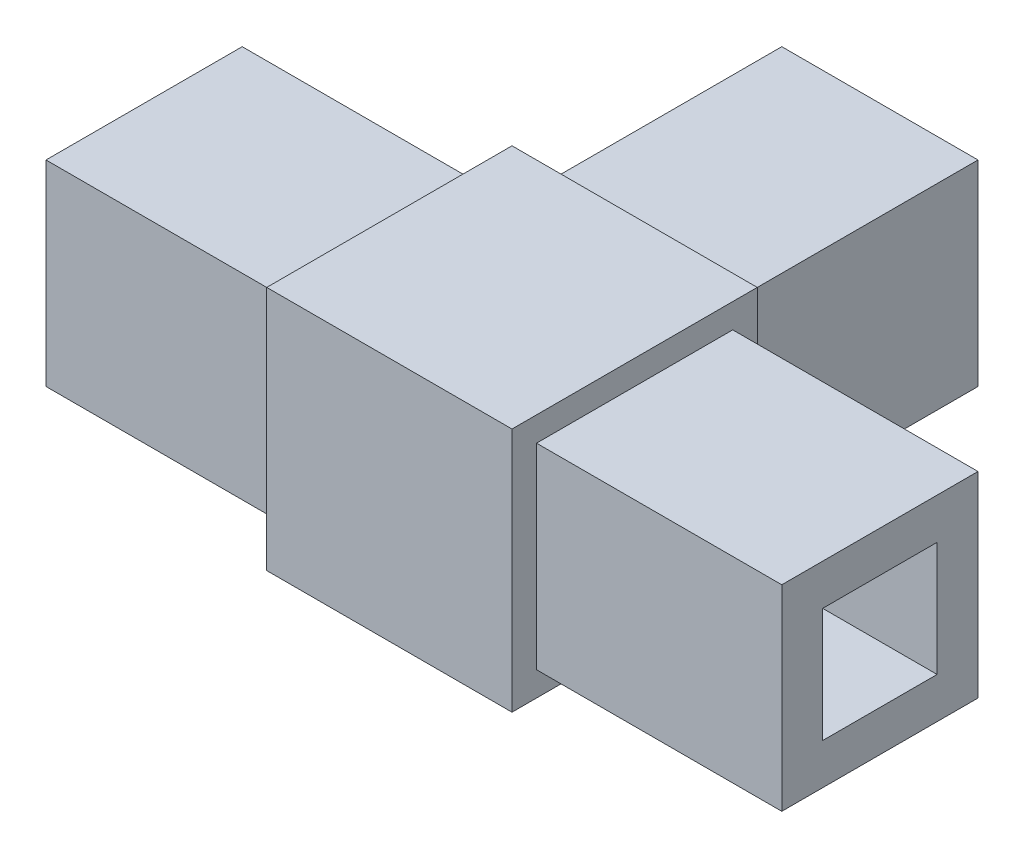
from build123d import *

# Parameters (mm, degrees)
CROQUIS1_W     = 30
CROQUIS1_H     = 30
EXTRUIR1_DEPTH = 30
CROQUIS2_W     = 30
CROQUIS2_H     = 30
CROQUIS2_W_2   = 24
CROQUIS2_H_2   = 24
EXTRUIR2_DEPTH = 30
CROQUIS3_W     = 30
CROQUIS3_H     = 30
CROQUIS3_W_2   = 24
CROQUIS3_H_2   = 24
EXTRUIR3_DEPTH = 30
CROQUIS5_W     = 30
CROQUIS5_H     = 30
CROQUIS5_W_2   = 24
CROQUIS5_H_2   = 24
EXTRUIR4_DEPTH = 30
VACIADO1_T     = -5


with BuildPart() as part:
    # Croquis1 → Extruir1 (new body)
    with BuildSketch(Plane(origin=(0, 0, 0), x_dir=(1, 0, 0), z_dir=(0, 1, 0))):
        with Locations((0, 30)):
            Rectangle(CROQUIS1_W, CROQUIS1_H)
        Rectangle(CROQUIS1_W, CROQUIS1_H)
        with Locations((30, 0)):
            Rectangle(CROQUIS1_W, CROQUIS1_H)
        with Locations((-30, 0)):
            Rectangle(CROQUIS1_W, CROQUIS1_H)
    extrude(amount=EXTRUIR1_DEPTH)

    # Croquis2 → Extruir2 (cut)
    with BuildSketch(Plane(origin=(45, 0, 0), x_dir=(0, 0, -1), z_dir=(1, 0, 0))):
        with Locations((0, 15)):
            Rectangle(CROQUIS2_W, CROQUIS2_H)
        with Locations((0, 15)):
            Rectangle(CROQUIS2_W_2, CROQUIS2_H_2, mode=Mode.SUBTRACT)
    extrude(amount=-EXTRUIR2_DEPTH, mode=Mode.SUBTRACT)

    # Croquis3 → Extruir3 (cut)
    with BuildSketch(Plane(origin=(0, 0, -45), x_dir=(-1, 0, 0), z_dir=(0, 0, -1))):
        with Locations((0, 15)):
            Rectangle(CROQUIS3_W, CROQUIS3_H)
        with Locations((0, 15)):
            Rectangle(CROQUIS3_W_2, CROQUIS3_H_2, mode=Mode.SUBTRACT)
    extrude(amount=-EXTRUIR3_DEPTH, mode=Mode.SUBTRACT)

    # Croquis5 → Extruir4 (cut)
    with BuildSketch(Plane.ZY.offset(45)):
        with Locations((0, 15)):
            Rectangle(CROQUIS5_W, CROQUIS5_H)
        with Locations((0, 15)):
            Rectangle(CROQUIS5_W_2, CROQUIS5_H_2, mode=Mode.SUBTRACT)
    extrude(amount=-EXTRUIR4_DEPTH, mode=Mode.SUBTRACT)

    # Vaciado1
    vaciado1_openings = [part.faces().sort_by_distance(p)[0] for p in [
        (45, 15, 0),
        (0, 15, -45),
        (-45, 15, 0),
    ]]
    offset(amount=VACIADO1_T, openings=vaciado1_openings, kind=Kind.INTERSECTION)


solid = part.part
